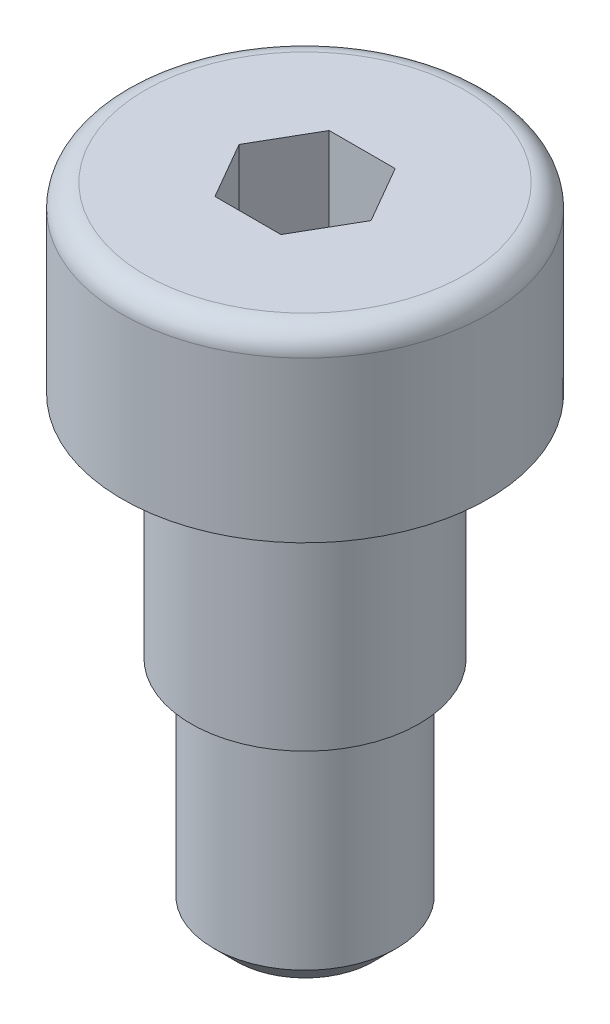
from build123d import *

# Parameters (mm, degrees)
ENL_V_MAT_EXTRU_1_DEPTH = 2


with BuildPart() as part:
    # Esquisse1 → Révolution1 (revolve)
    with BuildSketch(Plane.XY):
        with BuildLine():
            Line((0, 4), (-3.5, 4))
            ThreePointArc((-3.5, 4), (-3.853553391, 3.853553391), (-4, 3.5))
            Line((-4, 3.5), (-4, 0))
            Line((-4, 0), (-2.4935, 0))
            Line((-2.4935, 0), (-2.4935, -5.013))
            Line((-2.4935, -5.013), (-2, -5.013))
            Line((-2, -5.013), (-2, -9.513))
            Line((-2, -9.513), (-1.5, -10.013))
            Line((-1.5, -10.013), (0, -10.013))
            Line((0, -10.013), (0, 4))
        make_face()
    revolve(axis=Axis((0, 15.825722622, 0), (0, -1, 0)))

    # Esquisse2 → Enlèv. mat.-Extru.1 (cut)
    with BuildSketch(Plane(origin=(0, 4, 0), x_dir=(-1, 0, 0), z_dir=(0, 1, 0))):
        Polygon((-1.443375673, 0), (-0.721687836, -1.25), (0.721687836, -1.25), (1.443375673, 0), (0.721687836, 1.25), (-0.721687836, 1.25), align=None)
    extrude(amount=-ENL_V_MAT_EXTRU_1_DEPTH, mode=Mode.SUBTRACT)


solid = part.part
